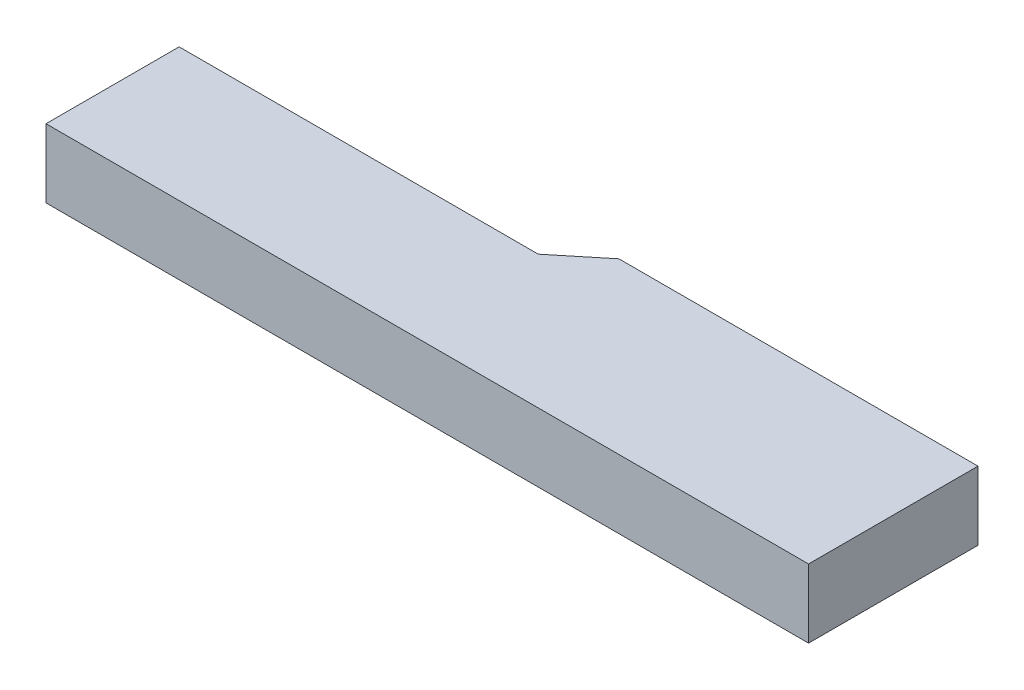
from build123d import *

# Parameters (mm, degrees)
EXTRUDE_4_DEPTH = 17


with BuildPart() as part:
    # 草图1 → 凸台-拉伸4 (new body)
    with BuildSketch(Plane(origin=(0, 0, 0), x_dir=(1, 0, 0), z_dir=(0, 1, 0))):
        Polygon((7.652815279, 19.992346423), (96.652815279, 19.992346423), (96.652815279, -22.007653577), (-92.347184721, -22.007653577), (-92.347184721, 10.992346423), (-3.347184721, 10.992346423), align=None)
    extrude(amount=EXTRUDE_4_DEPTH)


solid = part.part
